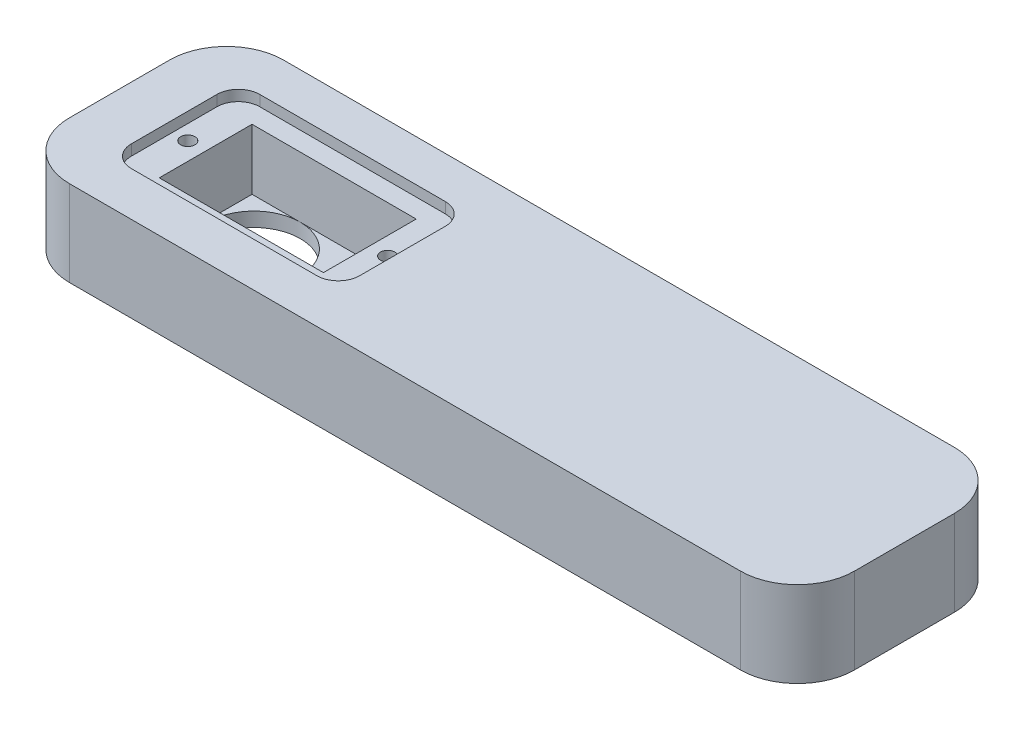
from build123d import *

# Parameters (mm, degrees)
SKETCH1_W           = 110
SKETCH1_H           = 30
BOSS_EXTRUDE1_DEPTH = 12
FILLET2_R           = 8
SKETCH4_R           = 6.5
CUT_EXTRUDE1_DEPTH  = 67.870108383
SKETCH3_W           = 23
SKETCH3_H           = 13
CUT_EXTRUDE2_DEPTH  = 10
SKETCH5_W           = 32
SKETCH5_H           = 18
CUT_EXTRUDE3_DEPTH  = 1.5
FILLET4_R           = 3
SKETCH6_R           = 1
CUT_EXTRUDE4_DEPTH  = 4


with BuildPart() as part:
    # Sketch1 → Boss-Extrude1 (new body)
    with BuildSketch(Plane(origin=(0, 0, 0), x_dir=(1, 0, 0), z_dir=(0, 1, 0))):
        with Locations((8.243243243, 3.108108108)):
            Rectangle(SKETCH1_W, SKETCH1_H)
    extrude(amount=BOSS_EXTRUDE1_DEPTH)

    # Fillet2
    fillet2_edges = [part.edges().sort_by_distance(p)[0] for p in [
        (-46.756756757, 6, -18.108108108),
        (63.243243243, 6, -18.108108108),
        (63.243243243, 6, 11.891891892),
        (-46.756756757, 6, 11.891891892),
    ]]
    fillet(fillet2_edges, radius=FILLET2_R)

    # Sketch4 → Cut-Extrude1 (cut, through all)
    with BuildSketch(Plane(origin=(0, 12, 0), x_dir=(1, 0, 0), z_dir=(0, 1, 0))):
        with Locations(Location((-27.929103529, 3.108108108, 0), (0, 0, 270))):
            Circle(SKETCH4_R)
    extrude(amount=-CUT_EXTRUDE1_DEPTH, mode=Mode.SUBTRACT)

    # Sketch3 → Cut-Extrude2 (cut)
    with BuildSketch(Plane(origin=(0, 12, 0), x_dir=(1, 0, 0), z_dir=(0, 1, 0))):
        with Locations((-23.179103529, 3.108108108)):
            Rectangle(SKETCH3_W, SKETCH3_H)
    extrude(amount=-CUT_EXTRUDE2_DEPTH, mode=Mode.SUBTRACT)

    # Sketch5 → Cut-Extrude3 (cut)
    with BuildSketch(Plane(origin=(0, 12, 0), x_dir=(1, 0, 0), z_dir=(0, 1, 0))):
        with Locations((-23.262280593, 3.273133416)):
            Rectangle(SKETCH5_W, SKETCH5_H)
    extrude(amount=-CUT_EXTRUDE3_DEPTH, mode=Mode.SUBTRACT)

    # Fillet4
    fillet4_edges = [part.edges().sort_by_distance(p)[0] for p in [
        (-39.262280593, 11.25, 5.726866584),
        (-39.262280593, 11.25, -12.273133416),
        (-7.262280593, 11.25, -12.273133416),
        (-7.262280593, 11.25, 5.726866584),
    ]]
    fillet(fillet4_edges, radius=FILLET4_R)

    # Sketch6 → Cut-Extrude4 (cut)
    with BuildSketch(Plane(origin=(0, 10.5, 0), x_dir=(1, 0, 0), z_dir=(0, 1, 0))):
        with Locations(Location((-37.179103529, 3.108108108, 0), (0, 0, 270))):
            Circle(SKETCH6_R)
        with Locations(Location((-9.179103529, 3.108108108, 0), (0, 0, 90))):
            Circle(SKETCH6_R)
    extrude(amount=-CUT_EXTRUDE4_DEPTH, mode=Mode.SUBTRACT)


solid = part.part
